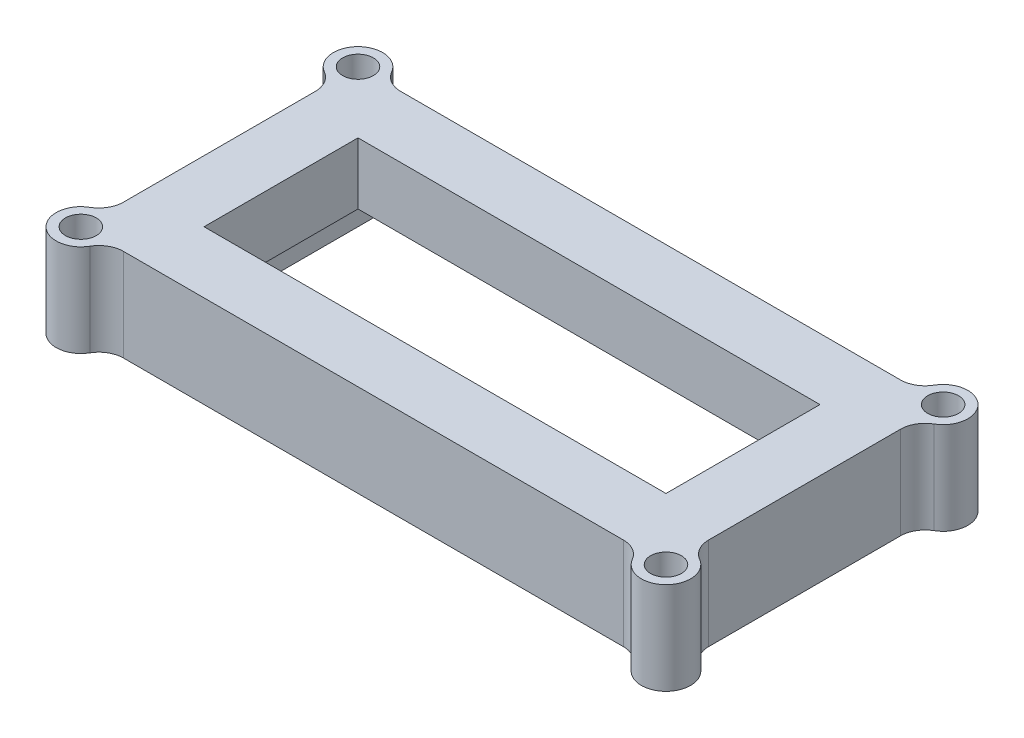
from build123d import *

# Parameters (mm, degrees)
SKETCH2_R           = 1.5
SKETCH2_W           = 75
SKETCH2_H           = 25
BOSS_EXTRUDE1_DEPTH = 15
FILLET3_R           = 4
FILLET4_R           = 4
FILLET5_R           = 4
FILLET6_R           = 4
FILLET7_R           = 4
FILLET8_R           = 4
FILLET9_R           = 4
FILLET10_R          = 4
SKETCH3_R           = 2.5
CUT_EXTRUDE1_DEPTH  = 10
SKETCH5_W           = 80
SKETCH5_H           = 36
CUT_EXTRUDE2_DEPTH  = 5


with BuildPart() as part:
    # Sketch2 → Boss-Extrude1 (new body)
    with BuildSketch(Plane(origin=(0, 0, 0), x_dir=(1, 0, 0), z_dir=(0, 1, 0))):
        with BuildLine():
            ThreePointArc((-43.5, 22.5), (-50.328427125, 25.328427125), (-47.5, 18.5))
            Line((-47.5, 18.5), (-47.5, -18.5))
            ThreePointArc((-47.5, -18.5), (-50.328427125, -25.328427125), (-43.5, -22.5))
            Line((-43.5, -22.5), (43.5, -22.5))
            ThreePointArc((43.5, -22.5), (50.328427125, -25.328427125), (47.5, -18.5))
            Line((47.5, -18.5), (47.5, 18.5))
            ThreePointArc((47.5, 18.5), (50.328427125, 25.328427125), (43.5, 22.5))
            Line((43.5, 22.5), (-43.5, 22.5))
        make_face()
        with Locations(Location((-47.5, 22.5, 0), (0, 0, 270))):
            Circle(SKETCH2_R, mode=Mode.SUBTRACT)
        with Locations(Location((-47.5, -22.5, 0), (0, 0, 270))):
            Circle(SKETCH2_R, mode=Mode.SUBTRACT)
        Rectangle(SKETCH2_W, SKETCH2_H, mode=Mode.SUBTRACT)
        with Locations(Location((47.5, 22.5, 0), (0, 0, 270))):
            Circle(SKETCH2_R, mode=Mode.SUBTRACT)
        with Locations(Location((47.5, -22.5, 0), (0, 0, 270))):
            Circle(SKETCH2_R, mode=Mode.SUBTRACT)
    extrude(amount=BOSS_EXTRUDE1_DEPTH)

    # Fillet3
    fillet3_edges = [part.edges().sort_by_distance(p)[0] for p in [
        (-43.5, 7.5, -22.5),
    ]]
    fillet(fillet3_edges, radius=FILLET3_R)

    # Fillet4
    fillet4_edges = [part.edges().sort_by_distance(p)[0] for p in [
        (-47.5, 7.5, -18.5),
    ]]
    fillet(fillet4_edges, radius=FILLET4_R)

    # Fillet5
    fillet5_edges = [part.edges().sort_by_distance(p)[0] for p in [
        (47.5, 7.5, -18.5),
    ]]
    fillet(fillet5_edges, radius=FILLET5_R)

    # Fillet6
    fillet6_edges = [part.edges().sort_by_distance(p)[0] for p in [
        (43.5, 7.5, -22.5),
    ]]
    fillet(fillet6_edges, radius=FILLET6_R)

    # Fillet7
    fillet7_edges = [part.edges().sort_by_distance(p)[0] for p in [
        (47.5, 7.5, 18.5),
    ]]
    fillet(fillet7_edges, radius=FILLET7_R)

    # Fillet8
    fillet8_edges = [part.edges().sort_by_distance(p)[0] for p in [
        (43.5, 7.5, 22.5),
    ]]
    fillet(fillet8_edges, radius=FILLET8_R)

    # Fillet9
    fillet9_edges = [part.edges().sort_by_distance(p)[0] for p in [
        (-43.5, 7.5, 22.5),
    ]]
    fillet(fillet9_edges, radius=FILLET9_R)

    # Fillet10
    fillet10_edges = [part.edges().sort_by_distance(p)[0] for p in [
        (-47.5, 7.5, 18.5),
    ]]
    fillet(fillet10_edges, radius=FILLET10_R)

    # Sketch3 → Cut-Extrude1 (cut)
    with BuildSketch(Plane(origin=(0, 15, 0), x_dir=(1, 0, 0), z_dir=(0, 1, 0))):
        with Locations(Location((-47.5, 22.5, 0), (0, 0, 270))):
            Circle(SKETCH3_R)
        with Locations(Location((47.5, 22.5, 0), (0, 0, 270))):
            Circle(SKETCH3_R)
        with Locations(Location((47.5, -22.5, 0), (0, 0, 270))):
            Circle(SKETCH3_R)
        with Locations(Location((-47.5, -22.5, 0), (0, 0, 270))):
            Circle(SKETCH3_R)
    extrude(amount=-CUT_EXTRUDE1_DEPTH, mode=Mode.SUBTRACT)

    # Sketch5 → Cut-Extrude2 (cut)
    with BuildSketch(Plane(origin=(0, 0, 0), x_dir=(-1, 0, 0), z_dir=(0, -1, 0))):
        Rectangle(SKETCH5_W, SKETCH5_H)
    extrude(amount=-CUT_EXTRUDE2_DEPTH, mode=Mode.SUBTRACT)


solid = part.part
